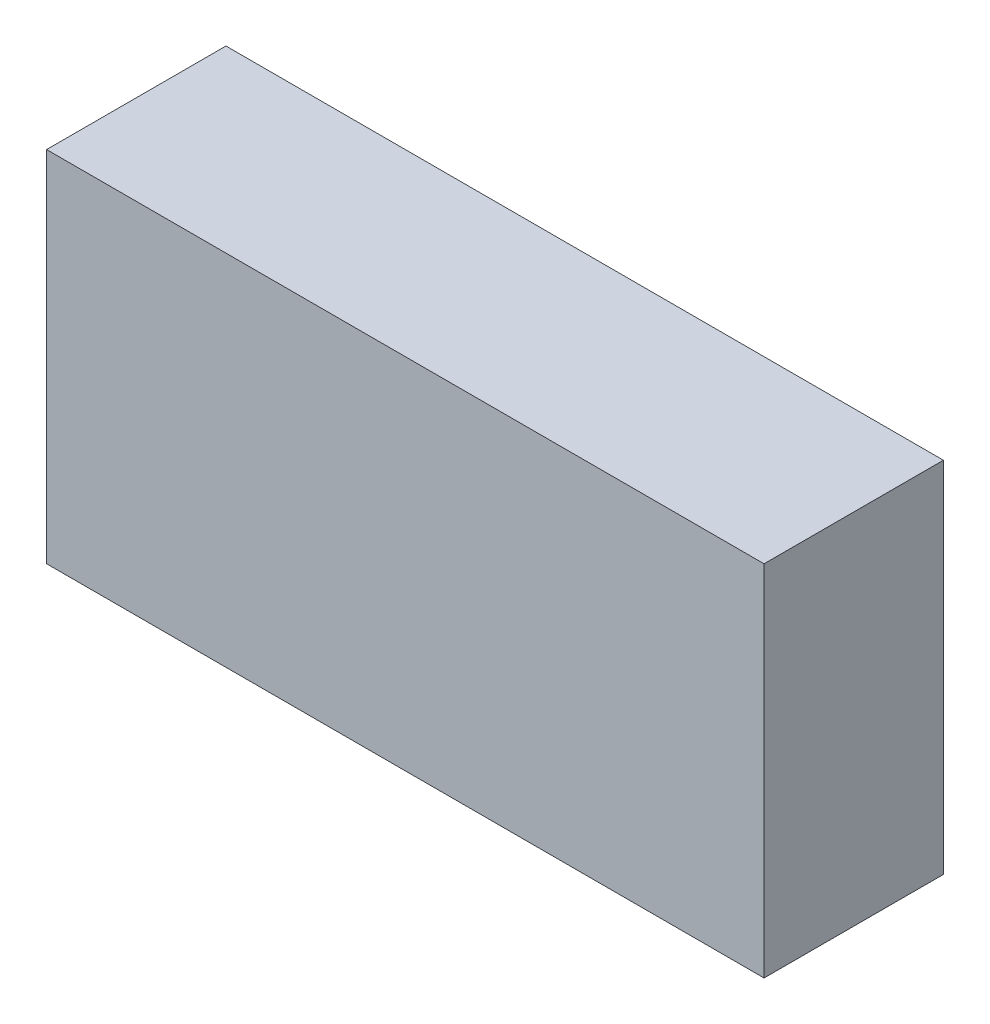
from build123d import *

# Parameters (mm, degrees)
SKETCH1_W           = 80
SKETCH1_H           = 40
BOSS_EXTRUDE1_DEPTH = 20
SKETCH2_R           = 10
BOSS_EXTRUDE2_DEPTH = 5
SKETCH3_R           = 5
BOSS_EXTRUDE3_DEPTH = 10


with BuildPart() as part:
    # Sketch1 → Boss-Extrude1 (new body)
    with BuildSketch(Plane.XY):
        with Locations((40, 20)):
            Rectangle(SKETCH1_W, SKETCH1_H)
    extrude(amount=-BOSS_EXTRUDE1_DEPTH)

    # Sketch2 → Boss-Extrude2 (add)
    with BuildSketch(Plane(origin=(0, 0, -20), x_dir=(-1, 0, 0), z_dir=(0, 0, -1))):
        with Locations((-40, 20)):
            Circle(SKETCH2_R)
    extrude(amount=BOSS_EXTRUDE2_DEPTH)

    # Sketch3 → Boss-Extrude3 (add)
    with BuildSketch(Plane(origin=(0, 0, -20), x_dir=(-1, 0, 0), z_dir=(0, 0, -1))):
        with Locations((-15, 20)):
            Circle(SKETCH3_R)
    boss_extrude3 = extrude(amount=BOSS_EXTRUDE3_DEPTH)

    # Mirror1: Boss-Extrude3 across plane
    add(boss_extrude3.mirror(Plane.ZY.offset(-40)))


solid = part.part
